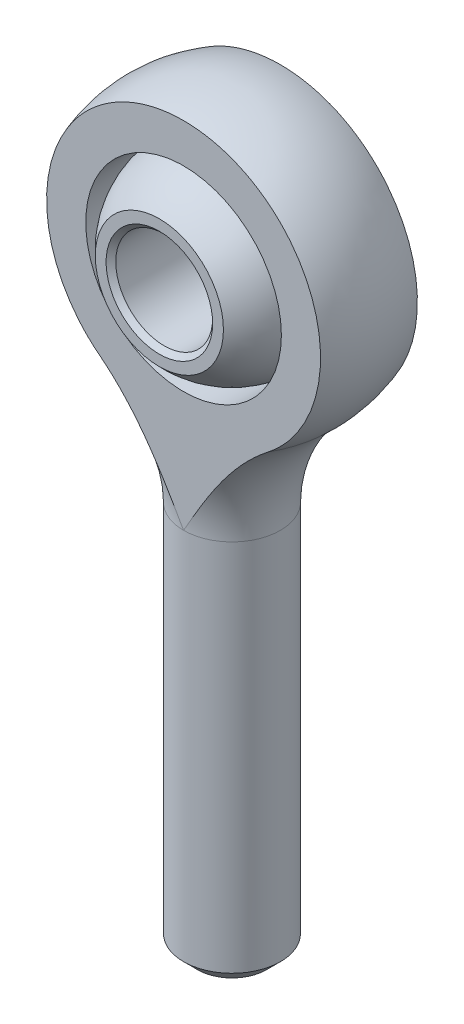
from build123d import *

# Parameters (mm, degrees)
SKETCH1_W               = 3.175
SKETCH1_H               = 25.4
CHAMFER2_SIZE           = 0.907142857
CUT_EXTRUDE1_DEPTH      = 29.750847814
CUT_EXTRUDE1_DEPTH_BACK = 29.750847814
CUT_EXTRUDE2_DEPTH      = 28.312382734
CUT_EXTRUDE2_DEPTH_BACK = 28.312382734
SKETCH6_R               = 6.4135
CUT_EXTRUDE3_DEPTH      = 28.86051193
CUT_EXTRUDE3_DEPTH_BACK = 28.86051193
SKETCH8_W               = 4.7625
SKETCH8_H               = 23.8125
CUT_EXTRUDE4_DEPTH      = 28.86051193
CUT_EXTRUDE4_DEPTH_BACK = 28.86051193
SKETCH10_R              = 3.175
CHAMFER1_SIZE           = 0.3175


with BuildPart() as part:
    # Sketch1 → Revolve1 (revolve)
    with BuildSketch(Plane.XY):
        with Locations((1.5875, -12.7)):
            Rectangle(SKETCH1_W, SKETCH1_H)
    revolve(axis=Axis((0, 23.8125, 0), (0, -1, 0)))

    # Chamfer2
    chamfer2_edges = [part.edges().sort_by_distance(p)[0] for p in [
        (-3.175, -25.4, 0),
    ]]
    chamfer(chamfer2_edges, length=CHAMFER2_SIZE)

    # Sketch4 → Revolve2 (revolve)
    with BuildSketch(Plane.XY):
        with BuildLine():
            Line((3.175, 0), (0, 0))
            Line((0, 0), (0, 23.8125))
            ThreePointArc((0, 23.8125), (8.890116899, 17.70677573), (6.382731959, 7.217396907))
            ThreePointArc((6.382731959, 7.217396907), (4.01304802, 3.949061991), (3.175, 0))
        make_face()
    revolve(axis=Axis((0, 23.8125, 0), (0, 1, 0)))

    # Sketch5 → Cut-Extrude1 (cut, two sides: drawn at the far end of the back side and taken through both)
    with BuildSketch(Plane(origin=(0, 0, 0), x_dir=(0, 0, -1), z_dir=(1, 0, 0)).offset(-CUT_EXTRUDE1_DEPTH_BACK)):
        Polygon((3.175, 23.8125), (9.525, 23.8125), (9.525, 0), (3.175, 0), (3.175, 1.27), align=None)
        Polygon((-3.175, 23.8125), (-3.175, 1.27), (-3.175, 0), (-9.525, 0), (-9.525, 23.8125), align=None)
    extrude(amount=CUT_EXTRUDE1_DEPTH + CUT_EXTRUDE1_DEPTH_BACK, mode=Mode.SUBTRACT)

    # Sketch6 → Cut-Extrude2 (cut, two sides: drawn at the far end of the back side and taken through both)
    with BuildSketch(Plane.XY.offset(-CUT_EXTRUDE2_DEPTH_BACK)):
        with Locations((0, 14.2875)):
            Circle(SKETCH6_R)
    extrude(amount=CUT_EXTRUDE2_DEPTH + CUT_EXTRUDE2_DEPTH_BACK, mode=Mode.SUBTRACT)


with BuildPart() as body_2:
    # Sketch7 → Revolve3 (revolve)
    with BuildSketch(Plane.XY):
        with BuildLine():
            Line((0, 20.6375), (0, 7.9375))
            ThreePointArc((0, 7.9375), (6.35, 14.2875), (0, 20.6375))
        make_face()
    revolve(axis=Axis((0, 0, 0), (0, 1, 0)))

    # Sketch8 → Cut-Extrude3 (cut, two sides: drawn at the far end of the back side and taken through both)
    with BuildSketch(Plane(origin=(0, 0, 0), x_dir=(0, 0, -1), z_dir=(1, 0, 0)).offset(-CUT_EXTRUDE3_DEPTH_BACK)):
        with Locations((-7.14375, 11.90625)):
            Rectangle(SKETCH8_W, SKETCH8_H)
        with Locations((7.14375, 11.90625)):
            Rectangle(SKETCH8_W, SKETCH8_H)
    extrude(amount=CUT_EXTRUDE3_DEPTH + CUT_EXTRUDE3_DEPTH_BACK, mode=Mode.SUBTRACT)

    # Sketch10 → Cut-Extrude4 (cut, two sides: drawn at the far end of the back side and taken through both)
    with BuildSketch(Plane.XY.offset(-CUT_EXTRUDE4_DEPTH_BACK)):
        with Locations((0, 14.2875)):
            Circle(SKETCH10_R)
    extrude(amount=CUT_EXTRUDE4_DEPTH + CUT_EXTRUDE4_DEPTH_BACK, mode=Mode.SUBTRACT)

    # Chamfer1
    chamfer1_edges = [body_2.edges().sort_by_distance(p)[0] for p in [
        (-3.175, 14.2875, -4.7625),
        (-3.175, 14.2875, 4.7625),
    ]]
    chamfer(chamfer1_edges, length=CHAMFER1_SIZE)


solid = Compound([part.part, body_2.part])
